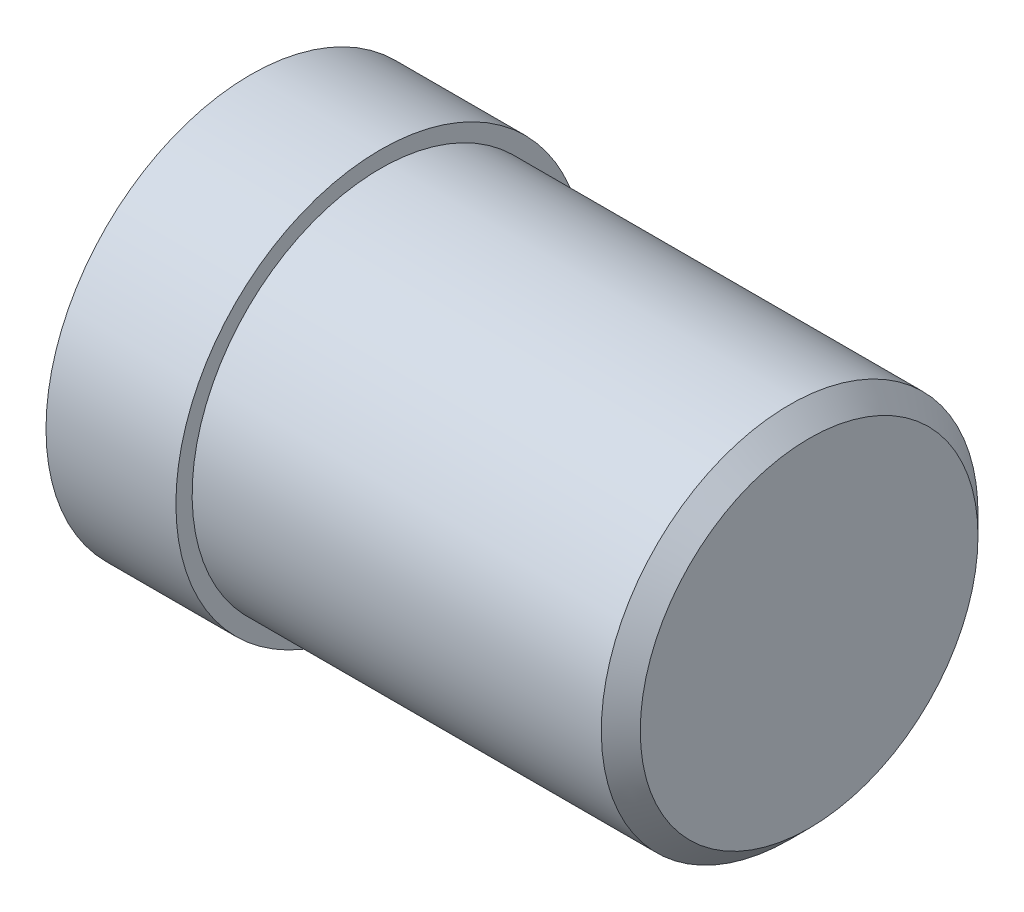
from build123d import *

# Parameters (mm, degrees)
ESBO_O2_R             = 2.848867015
CORTE_EXTRUS_O1_DEPTH = 0.2


with BuildPart() as part:
    # Esboço1 → Revolução1 (revolve)
    with BuildSketch(Plane.XY, mode=Mode.PRIVATE) as revolu_o1_sk:
        Polygon((8.3, 2.9), (8.6, 2.6), (8.6, 2.55), (8.6, 0), (8.45, 0), (8.45, 2.55), (0, 2.55), (0, 3.15), (2, 3.15), (2, 2.9), align=None)
    revolve(revolu_o1_sk.sketch.rotate(Axis((0, 0, 0), (1, 0, 0)), 180), axis=Axis((0, 0, 0), (1, 0, 0)))

    # Esboço2 → Corte-extrusão1 (cut)
    with BuildSketch(Plane(origin=(0, 0, 0), x_dir=(0, 0, -1), z_dir=(1, 0, 0))):
        Circle(ESBO_O2_R)
    extrude(amount=CORTE_EXTRUS_O1_DEPTH, mode=Mode.SUBTRACT)


solid = part.part
